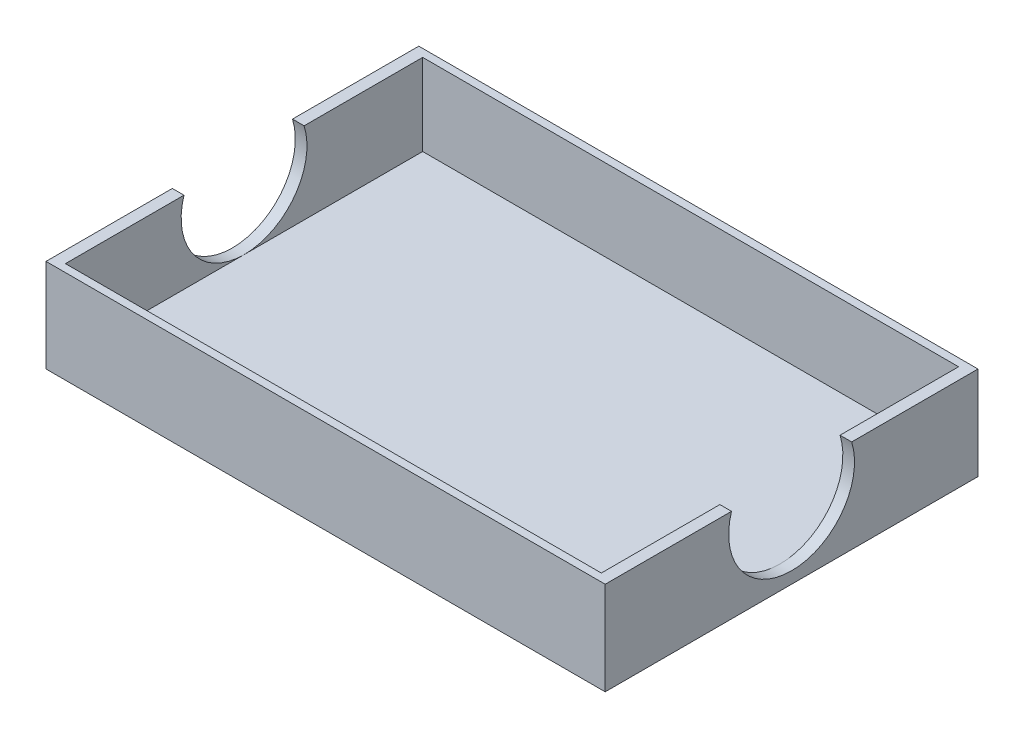
from build123d import *

# Parameters (mm, degrees)
SKETCH1_W           = 120
SKETCH1_H           = 80
SKETCH1_W_2         = 115
SKETCH1_H_2         = 76.666666666
BOSS_EXTRUDE1_DEPTH = 20
SKETCH1_3_W         = 115
SKETCH1_3_H         = 76.666666666
BOSS_EXTRUDE2_DEPTH = 2.5
SKETCH2_R           = 13.5
CUT_EXTRUDE1_DEPTH  = 129.062484749


with BuildPart() as part:
    # Sketch1 → Boss-Extrude1 (new body)
    with BuildSketch(Plane(origin=(0, 0, 0), x_dir=(1, 0, 0), z_dir=(0, 1, 0))):
        Rectangle(SKETCH1_W, SKETCH1_H)
        Rectangle(SKETCH1_W_2, SKETCH1_H_2, mode=Mode.SUBTRACT)
    extrude(amount=BOSS_EXTRUDE1_DEPTH)

    # Sketch1<3> → Boss-Extrude2 (add)
    with BuildSketch(Plane(origin=(0, 0, 0), x_dir=(1, 0, 0), z_dir=(0, 1, 0))):
        Rectangle(SKETCH1_3_W, SKETCH1_3_H)
    extrude(amount=BOSS_EXTRUDE2_DEPTH)

    # Sketch2 → Cut-Extrude1 (cut, through all)
    with BuildSketch(Plane.ZY.offset(60)):
        with Locations((0, 16)):
            Circle(SKETCH2_R)
    extrude(amount=-CUT_EXTRUDE1_DEPTH, mode=Mode.SUBTRACT)


solid = part.part
